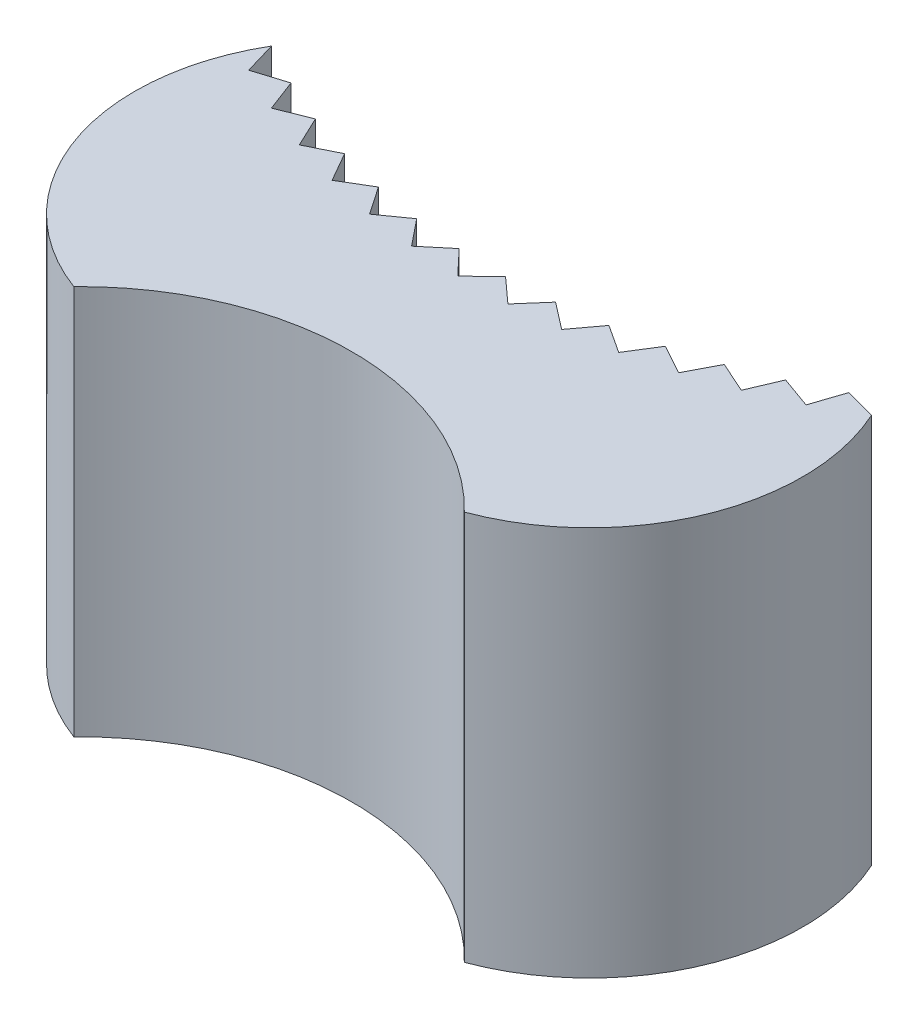
from build123d import *

# Parameters (mm, degrees)
BOSS_EXTRUDE1_DEPTH = 4.191
CUT_EXTRUDE1_START  = -4.191
CUT_EXTRUDE1_DEPTH  = 4.191
CIRPATTERN1_COUNT   = 15
CIRPATTERN1_ANGLE   = 63


with BuildPart() as part:
    # Sketch1 → Boss-Extrude1 (new body)
    with BuildSketch(Plane(origin=(0, 0, 0), x_dir=(1, 0, 0), z_dir=(0, 1, 0))):
        with BuildLine():
            ThreePointArc((-3.275024427, 1.651), (0, 0.762), (3.275024427, 1.651))
            ThreePointArc((3.275024427, 1.651), (3.45634833, -0.274256168), (2.098384379, -1.651))
            ThreePointArc((2.098384379, -1.651), (0, -0.762), (-2.098384379, -1.651))
            ThreePointArc((-2.098384379, -1.651), (-3.45634833, -0.274256168), (-3.275024427, 1.651))
        make_face()
    extrude(amount=BOSS_EXTRUDE1_DEPTH)

    # Sketch2 → Cut-Extrude1 (cut)
    with BuildSketch(Plane(origin=(0, 4.191, 0), x_dir=(1, 0, 0), z_dir=(0, 1, 0)).offset(CUT_EXTRUDE1_START)):
        with BuildLine():
            ThreePointArc((-3.053367923, 1.526866132), (-3.16480485, 1.587846201), (-3.275024427, 1.651))
            Line((-3.275024427, 1.651), (-3.173107841, 1.302860882))
            Line((-3.173107841, 1.302860882), (-3.053367923, 1.526866132))
        make_face()
        with BuildLine():
            Line((-3.053367923, 1.526866132), (-3.173107841, 1.302860882))
            Line((-3.173107841, 1.302860882), (-2.827013928, 1.411520163))
            ThreePointArc((-2.827013928, 1.411520163), (-2.94075651, 1.468083249), (-3.053367923, 1.526866132))
        make_face()
    cut_extrude1 = extrude(amount=CUT_EXTRUDE1_DEPTH, mode=Mode.SUBTRACT)

    # CirPattern1: Cut-Extrude1 ×15 about axis
    cirpattern1_axis = Axis((0, 0, -7.239), (0, 1, 0))
    for i in range(1, CIRPATTERN1_COUNT):
        add(cut_extrude1.rotate(cirpattern1_axis, i * CIRPATTERN1_ANGLE / (CIRPATTERN1_COUNT - 1)), mode=Mode.SUBTRACT)


solid = part.part
